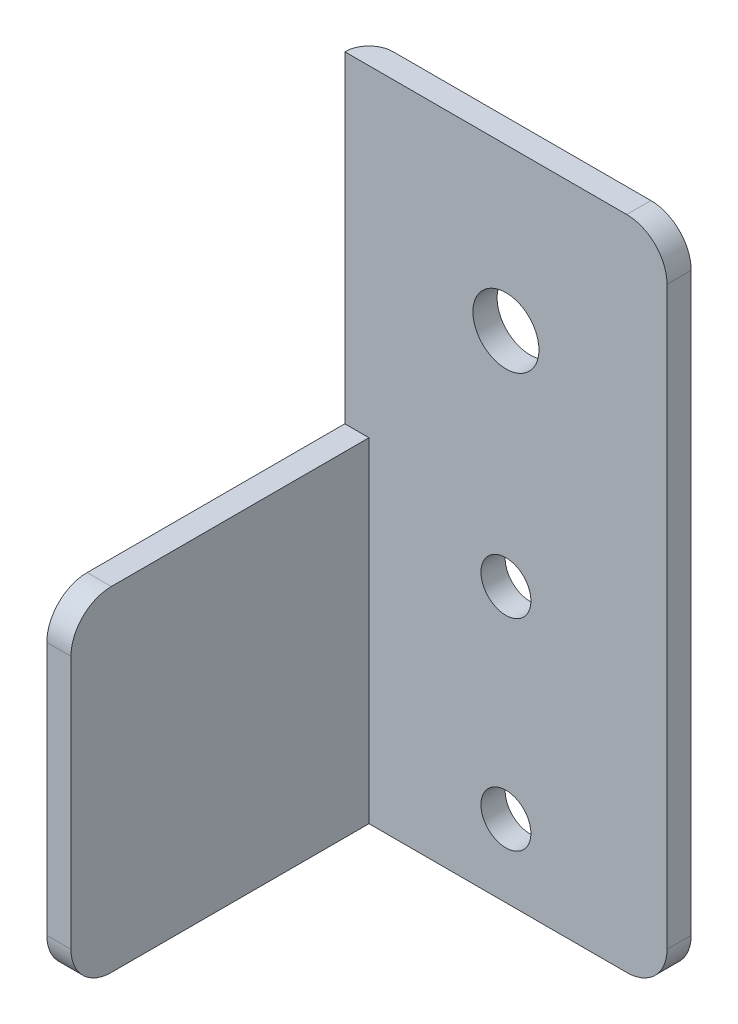
from build123d import *

# Parameters (mm, degrees)
EXTRUDE_THIN1_DEPTH = 81.5
SKETCH2_W           = 37
SKETCH2_H           = 40
CUT_EXTRUDE1_DEPTH  = 10
SKETCH3_R           = 4.1
CUT_EXTRUDE2_DEPTH  = 10
SKETCH4_R           = 3.1
CUT_EXTRUDE3_DEPTH  = 10
FILLET1_R           = 5


with BuildPart() as part:
    # Sketch1 → Extrude-Thin1 (new body)
    with BuildSketch(Plane(origin=(0, 0, 0), x_dir=(1, 0, 0), z_dir=(0, 1, 0))):
        with BuildLine():
            Line((40, 0), (3, 0))
            ThreePointArc((3, 0), (0.878679656, -0.878679656), (0, -3))
            Line((0, -3), (0, -40))
            Line((0, -40), (3, -40))
            Line((3, -40), (3, -3))
            Line((3, -3), (40, -3))
            Line((40, -3), (40, 0))
        make_face()
    extrude(amount=EXTRUDE_THIN1_DEPTH)

    # Sketch2 → Cut-Extrude1 (cut)
    with BuildSketch(Plane(origin=(3, 0, 0), x_dir=(0, 0, -1), z_dir=(1, 0, 0))):
        with Locations((-21.5, 61.5)):
            Rectangle(SKETCH2_W, SKETCH2_H)
    extrude(amount=-CUT_EXTRUDE1_DEPTH, mode=Mode.SUBTRACT)

    # Sketch3 → Cut-Extrude2 (cut)
    with BuildSketch(Plane(origin=(0, 0, 0), x_dir=(-1, 0, 0), z_dir=(0, 0, -1))):
        with Locations((-20, 61.5)):
            Circle(SKETCH3_R)
    extrude(amount=-CUT_EXTRUDE2_DEPTH, mode=Mode.SUBTRACT)

    # Sketch4 → Cut-Extrude3 (cut)
    with BuildSketch(Plane(origin=(0, 0, 0), x_dir=(-1, 0, 0), z_dir=(0, 0, -1))):
        with Locations((-20, 9)):
            Circle(SKETCH4_R)
        with Locations((-20, 34)):
            Circle(SKETCH4_R)
    extrude(amount=-CUT_EXTRUDE3_DEPTH, mode=Mode.SUBTRACT)

    # Fillet1
    fillet1_edges = [part.edges().sort_by_distance(p)[0] for p in [
        (1.5, 41.5, 40),
        (1.5, 0, 40),
        (40, 81.5, 1.5),
        (40, 0, 1.5),
    ]]
    fillet(fillet1_edges, radius=FILLET1_R)


solid = part.part
